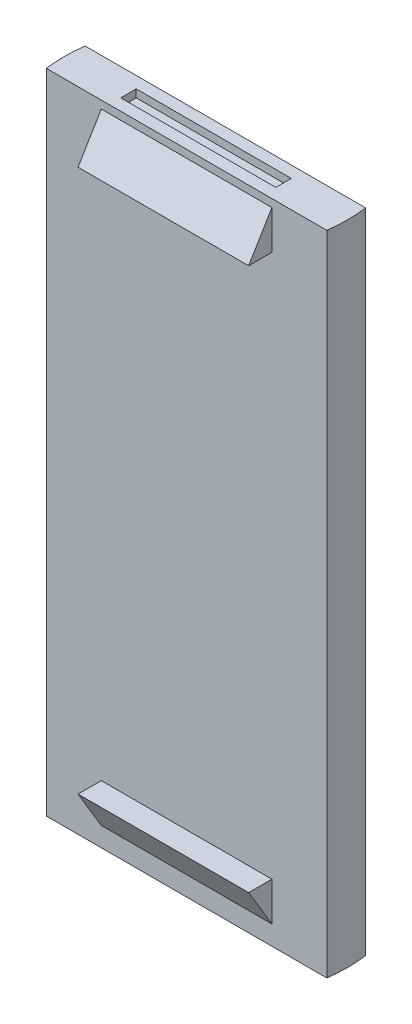
from build123d import *

# Parameters (mm, degrees)
SKETCH1_W               = 99.06
SKETCH1_H               = 360.68
BOSS_EXTRUDE1_DEPTH     = 12.7
SKETCH3_W               = 32.004
SKETCH3_H               = 11.43
BOSS_EXTRUDE3_DEPTH     = 20.32
SKETCH2_W               = 55.88
SKETCH2_H               = 12.7
BOSS_EXTRUDE4_DEPTH     = 7.62
CUT_EXTRUDE2_DEPTH      = 38.1
SKETCH6_W               = 50.8
SKETCH6_H               = 5.08
CUT_EXTRUDE3_DEPTH      = 2.54
SKETCH7_R               = 50.8
SKETCH7_R_2             = 46.355
CUT_EXTRUDE4_DEPTH      = 366.559302576
CUT_EXTRUDE5_DEPTH      = 190.107435139
CUT_EXTRUDE5_DEPTH_BACK = 190.107435139
SKETCH8_W               = 158.320369358
SKETCH8_H               = 163.138922325


with BuildPart() as part:
    # Sketch1 → Boss-Extrude1 (new body)
    with BuildSketch(Plane.XY):
        Rectangle(SKETCH1_W, SKETCH1_H)
    extrude(amount=BOSS_EXTRUDE1_DEPTH)

    # Sketch3 → Boss-Extrude3 (add)
    with BuildSketch(Plane(origin=(0, 0, 0), x_dir=(-1, 0, 0), z_dir=(0, 0, -1))):
        with Locations((0, -43.815)):
            Rectangle(SKETCH3_W, SKETCH3_H)
        with Locations((0, -159.385)):
            Rectangle(SKETCH3_W, SKETCH3_H)
    boss_extrude3 = extrude(amount=BOSS_EXTRUDE3_DEPTH)

    # Sketch2 → Boss-Extrude4 (add, symmetric)
    with BuildSketch(Plane.XY.offset(12.7)):
        with Locations((0, 171.45)):
            Rectangle(SKETCH2_W, SKETCH2_H)
        with Locations((0, -19.05)):
            Rectangle(SKETCH2_W, SKETCH2_H)
    extrude(amount=BOSS_EXTRUDE4_DEPTH, both=True)

    # Mirror1: Boss-Extrude3 across plane
    add(boss_extrude3.mirror(Plane.XY.offset(6.35)))

    # Sketch5 → Cut-Extrude2 (cut, symmetric)
    with BuildSketch(Plane(origin=(0, 0, 0), x_dir=(0, 0, -1), z_dir=(1, 0, 0))):
        Polygon((20.32, -153.67), (0, -165.1), (20.32, -165.1), align=None)
        Polygon((-33.02, -153.67), (-12.7, -165.1), (-33.02, -165.1), align=None)
        Polygon((-33.02, -49.53), (-33.02, -38.1), (-12.7, -38.1), align=None)
        Polygon((20.32, -49.53), (0, -38.1), (20.32, -38.1), align=None)
        Polygon((-12.7, 177.8), (-20.32, 165.1), (-20.32, 177.8), align=None)
        Polygon((-20.32, -12.7), (-12.7, -25.4), (-20.32, -25.4), align=None)
    extrude(amount=CUT_EXTRUDE2_DEPTH, both=True, mode=Mode.SUBTRACT)

    # Sketch6 → Cut-Extrude3 (cut)
    with BuildSketch(Plane(origin=(0, 180.34, 0), x_dir=(1, 0, 0), z_dir=(0, 1, 0))):
        with Locations((0, -6.35)):
            Rectangle(SKETCH6_W, SKETCH6_H)
    cut_extrude3 = extrude(amount=-CUT_EXTRUDE3_DEPTH, mode=Mode.SUBTRACT)

    # Mirror2: Cut-Extrude3 across plane
    add(cut_extrude3.mirror(Plane.ZX), mode=Mode.SUBTRACT)

    # Sketch7 → Cut-Extrude4 (cut, through all)
    with BuildSketch(Plane(origin=(0, 180.34, 0), x_dir=(1, 0, 0), z_dir=(0, 1, 0))):
        with Locations((0, -6.35)):
            Circle(SKETCH7_R)
        with Locations((0, -6.35)):
            Circle(SKETCH7_R_2, mode=Mode.SUBTRACT)
    extrude(amount=-CUT_EXTRUDE4_DEPTH, mode=Mode.SUBTRACT)

    # Sketch8 → Cut-Extrude5 (cut, two sides: drawn at the far end of the back side and taken through both)
    with BuildSketch(Plane.XY.offset(-CUT_EXTRUDE5_DEPTH_BACK)):
        with Locations((0.168785042, -113.319461163)):
            Rectangle(SKETCH8_W, SKETCH8_H)
    extrude(amount=CUT_EXTRUDE5_DEPTH + CUT_EXTRUDE5_DEPTH_BACK, mode=Mode.SUBTRACT)


solid = part.part
